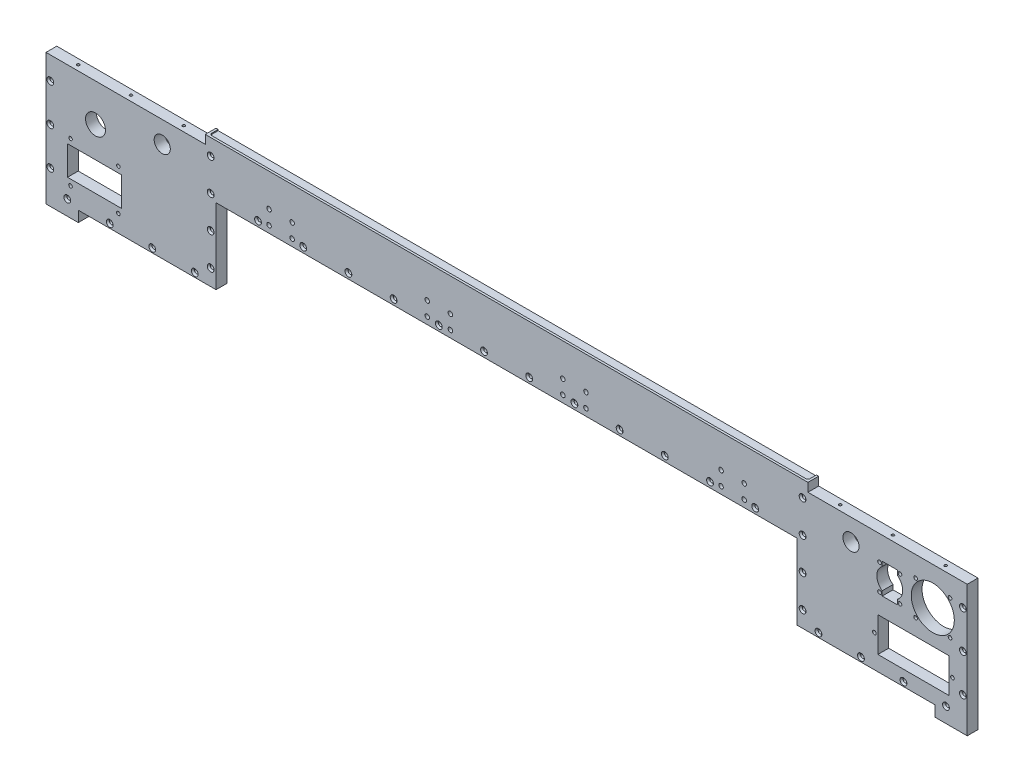
from build123d import *

# Parameters (mm, degrees)
BOSS_EXTRUDE1_DEPTH                          = 10
M3X0_5_TAPPED_HOLE1_AT_2_COUNT               = 2
M3X0_5_TAPPED_HOLE1_AT_2_PITCH               = 49
M3X0_5_TAPPED_HOLE1_AT_3_COUNT               = 2
M3X0_5_TAPPED_HOLE1_AT_3_PITCH               = 98
CSK_FOR_M3_COUNTERSUNK_FLAT_HEAD1_AT_2_COUNT = 2
CSK_FOR_M3_COUNTERSUNK_FLAT_HEAD1_AT_2_PITCH = 39.5
CSK_FOR_M3_COUNTERSUNK_FLAT_HEAD1_AT_3_COUNT = 2
CSK_FOR_M3_COUNTERSUNK_FLAT_HEAD1_AT_3_PITCH = 79
CSK_FOR_M3_COUNTERSUNK_FLAT_HEAD1_AT_4_COUNT = 2
CSK_FOR_M3_COUNTERSUNK_FLAT_HEAD1_AT_4_PITCH = 118.5
CSK_FOR_M3_COUNTERSUNK_FLAT_HEAD2_AT_2_COUNT = 2
CSK_FOR_M3_COUNTERSUNK_FLAT_HEAD2_AT_2_PITCH = 35
CSK_FOR_M3_COUNTERSUNK_FLAT_HEAD2_AT_3_COUNT = 2
CSK_FOR_M3_COUNTERSUNK_FLAT_HEAD2_AT_3_PITCH = 70
CSK_FOR_M3_COUNTERSUNK_FLAT_HEAD3_AT_2_COUNT = 2
CSK_FOR_M3_COUNTERSUNK_FLAT_HEAD3_AT_2_PITCH = 30
CSK_FOR_M3_COUNTERSUNK_FLAT_HEAD3_AT_3_COUNT = 2
CSK_FOR_M3_COUNTERSUNK_FLAT_HEAD3_AT_3_PITCH = 60
CSK_FOR_M3_COUNTERSUNK_FLAT_HEAD3_AT_4_COUNT = 2
CSK_FOR_M3_COUNTERSUNK_FLAT_HEAD3_AT_4_PITCH = 90
CSK_FOR_M3_COUNTERSUNK_FLAT_HEAD4_AT_2_COUNT = 2
CSK_FOR_M3_COUNTERSUNK_FLAT_HEAD4_AT_2_PITCH = 42
CSK_FOR_M3_COUNTERSUNK_FLAT_HEAD4_AT_3_COUNT = 2
CSK_FOR_M3_COUNTERSUNK_FLAT_HEAD4_AT_3_PITCH = 84
CSK_FOR_M3_COUNTERSUNK_FLAT_HEAD4_AT_4_COUNT = 2
CSK_FOR_M3_COUNTERSUNK_FLAT_HEAD4_AT_4_PITCH = 126
CSK_FOR_M3_COUNTERSUNK_FLAT_HEAD4_AT_5_COUNT = 2
CSK_FOR_M3_COUNTERSUNK_FLAT_HEAD4_AT_5_PITCH = 168
CSK_FOR_M3_COUNTERSUNK_FLAT_HEAD4_AT_6_COUNT = 2
CSK_FOR_M3_COUNTERSUNK_FLAT_HEAD4_AT_6_PITCH = 210
SKETCH14_W                                   = 556
SKETCH14_H                                   = 8
CUT_EXTRUDE1_DEPTH                           = 1
FILLET1_R                                    = 2
SKETCH17_R                                   = 20
SKETCH17_W                                   = 66
SKETCH17_H                                   = 32
CUT_EXTRUDE4_DEPTH                           = 436.527266655
F_3_4_3_4_DIAMETER_HOLE1_D                   = 3.4
M4X0_7_TAPPED_HOLE1_D                        = 3.3
SKETCH21_W                                   = 50
SKETCH21_H                                   = 27
CUT_EXTRUDE5_DEPTH                           = 436.527266655
M5X0_8_TAPPED_HOLE1_D                        = 4.2
LPATTERN1_COUNT                              = 2
LPATTERN1_PITCH                              = 147
MIRROR2_COPY_1_D                             = 4.2
M20X1_5_TAPPED_HOLE1_D                       = 18.5
F_15_0_15_DIAMETER_HOLE1_D                   = 15


with BuildPart() as part:
    # Sketch1 → Boss-Extrude1 (new body)
    with BuildSketch(Plane.XY):
        Polygon((270, 0), (-270, 0), (-270, -70), (-398, -70), (-398, -80), (-428, -80), (-428, 42), (-280, 42), (-280, 50), (280, 50), (280, 42), (428, 42), (428, -80), (398, -80), (398, -70), (270, -70), align=None)
    extrude(amount=BOSS_EXTRUDE1_DEPTH)

    # Sketch4 → M3x0.5 Tapped Hole1 (revolve, cut)
    with BuildSketch(Plane(origin=(-403, 42, 5), x_dir=(0, 0, 1), z_dir=(1, 0, 0))):
        Polygon((0, 0), (0, 12.251075774), (1.25, 11.5), (1.25, 0), align=None)
    m3x0_5_tapped_hole1 = revolve(axis=Axis((-403, 48.35, 5), (0, -1, 0)), mode=Mode.SUBTRACT)

    # M3x0.5 Tapped Hole1 at 2: M3x0.5 Tapped Hole1 ×2
    with Locations(*[(i * M3X0_5_TAPPED_HOLE1_AT_2_PITCH, 0, 0) for i in range(1, M3X0_5_TAPPED_HOLE1_AT_2_COUNT)]):
        add(m3x0_5_tapped_hole1, mode=Mode.SUBTRACT)

    # M3x0.5 Tapped Hole1 at 3: M3x0.5 Tapped Hole1 ×2
    with Locations(*[(i * M3X0_5_TAPPED_HOLE1_AT_3_PITCH, 0, 0) for i in range(1, M3X0_5_TAPPED_HOLE1_AT_3_COUNT)]):
        add(m3x0_5_tapped_hole1, mode=Mode.SUBTRACT)

    # Sketch6 → CSK for M3 Countersunk Flat Head1 (revolve, cut)
    with BuildSketch(Plane(origin=(-408.25, -66, 10), x_dir=(0, -1, 0), z_dir=(1, 0, 0))):
        Polygon((0, 0), (0, 12.521463052), (1.7, 11.5), (1.7, 1.45), (3.15, 0), align=None)
    csk_for_m3_countersunk_flat_head1 = revolve(axis=Axis((-408.25, -66, 16.35), (0, 0, -1)), mode=Mode.SUBTRACT)

    # CSK for M3 Countersunk Flat Head1 at 2: CSK for M3 Countersunk Flat Head1 ×2
    with Locations(*[(i * CSK_FOR_M3_COUNTERSUNK_FLAT_HEAD1_AT_2_PITCH, 0, 0) for i in range(1, CSK_FOR_M3_COUNTERSUNK_FLAT_HEAD1_AT_2_COUNT)]):
        add(csk_for_m3_countersunk_flat_head1, mode=Mode.SUBTRACT)

    # CSK for M3 Countersunk Flat Head1 at 3: CSK for M3 Countersunk Flat Head1 ×2
    with Locations(*[(i * CSK_FOR_M3_COUNTERSUNK_FLAT_HEAD1_AT_3_PITCH, 0, 0) for i in range(1, CSK_FOR_M3_COUNTERSUNK_FLAT_HEAD1_AT_3_COUNT)]):
        add(csk_for_m3_countersunk_flat_head1, mode=Mode.SUBTRACT)

    # CSK for M3 Countersunk Flat Head1 at 4: CSK for M3 Countersunk Flat Head1 ×2
    with Locations(*[(i * CSK_FOR_M3_COUNTERSUNK_FLAT_HEAD1_AT_4_PITCH, 0, 0) for i in range(1, CSK_FOR_M3_COUNTERSUNK_FLAT_HEAD1_AT_4_COUNT)]):
        add(csk_for_m3_countersunk_flat_head1, mode=Mode.SUBTRACT)

    # Sketch8 → CSK for M3 Countersunk Flat Head2 (revolve, cut)
    with BuildSketch(Plane(origin=(-424, 21, 10), x_dir=(0, -1, 0), z_dir=(1, 0, 0))):
        Polygon((0, 0), (0, 12.521463052), (1.7, 11.5), (1.7, 1.45), (3.15, 0), align=None)
    csk_for_m3_countersunk_flat_head2 = revolve(axis=Axis((-424, 21, 16.35), (0, 0, -1)), mode=Mode.SUBTRACT)

    # CSK for M3 Countersunk Flat Head2 at 2: CSK for M3 Countersunk Flat Head2 ×2
    with Locations(*[(0, -i * CSK_FOR_M3_COUNTERSUNK_FLAT_HEAD2_AT_2_PITCH, 0) for i in range(1, CSK_FOR_M3_COUNTERSUNK_FLAT_HEAD2_AT_2_COUNT)]):
        add(csk_for_m3_countersunk_flat_head2, mode=Mode.SUBTRACT)

    # CSK for M3 Countersunk Flat Head2 at 3: CSK for M3 Countersunk Flat Head2 ×2
    with Locations(*[(0, -i * CSK_FOR_M3_COUNTERSUNK_FLAT_HEAD2_AT_3_PITCH, 0) for i in range(1, CSK_FOR_M3_COUNTERSUNK_FLAT_HEAD2_AT_3_COUNT)]):
        add(csk_for_m3_countersunk_flat_head2, mode=Mode.SUBTRACT)

    # Sketch11 → CSK for M3 Countersunk Flat Head3 (revolve, cut)
    with BuildSketch(Plane(origin=(-275, 35, 10), x_dir=(0, -1, 0), z_dir=(1, 0, 0))):
        Polygon((0, 0), (0, 12.521463052), (1.7, 11.5), (1.7, 1.45), (3.15, 0), align=None)
    csk_for_m3_countersunk_flat_head3 = revolve(axis=Axis((-275, 35, 16.35), (0, 0, -1)), mode=Mode.SUBTRACT)

    # CSK for M3 Countersunk Flat Head3 at 2: CSK for M3 Countersunk Flat Head3 ×2
    with Locations(*[(0, -i * CSK_FOR_M3_COUNTERSUNK_FLAT_HEAD3_AT_2_PITCH, 0) for i in range(1, CSK_FOR_M3_COUNTERSUNK_FLAT_HEAD3_AT_2_COUNT)]):
        add(csk_for_m3_countersunk_flat_head3, mode=Mode.SUBTRACT)

    # CSK for M3 Countersunk Flat Head3 at 3: CSK for M3 Countersunk Flat Head3 ×2
    with Locations(*[(0, -i * CSK_FOR_M3_COUNTERSUNK_FLAT_HEAD3_AT_3_PITCH, 0) for i in range(1, CSK_FOR_M3_COUNTERSUNK_FLAT_HEAD3_AT_3_COUNT)]):
        add(csk_for_m3_countersunk_flat_head3, mode=Mode.SUBTRACT)

    # CSK for M3 Countersunk Flat Head3 at 4: CSK for M3 Countersunk Flat Head3 ×2
    with Locations(*[(0, -i * CSK_FOR_M3_COUNTERSUNK_FLAT_HEAD3_AT_4_PITCH, 0) for i in range(1, CSK_FOR_M3_COUNTERSUNK_FLAT_HEAD3_AT_4_COUNT)]):
        add(csk_for_m3_countersunk_flat_head3, mode=Mode.SUBTRACT)

    # Sketch13 → CSK for M3 Countersunk Flat Head4 (revolve, cut)
    with BuildSketch(Plane(origin=(-231, 5, 10), x_dir=(0, -1, 0), z_dir=(1, 0, 0))):
        Polygon((0, 0), (0, 12.521463052), (1.7, 11.5), (1.7, 1.45), (3.15, 0), align=None)
    csk_for_m3_countersunk_flat_head4 = revolve(axis=Axis((-231, 5, 16.35), (0, 0, -1)), mode=Mode.SUBTRACT)

    # CSK for M3 Countersunk Flat Head4 at 2: CSK for M3 Countersunk Flat Head4 ×2
    with Locations(*[(i * CSK_FOR_M3_COUNTERSUNK_FLAT_HEAD4_AT_2_PITCH, 0, 0) for i in range(1, CSK_FOR_M3_COUNTERSUNK_FLAT_HEAD4_AT_2_COUNT)]):
        add(csk_for_m3_countersunk_flat_head4, mode=Mode.SUBTRACT)

    # CSK for M3 Countersunk Flat Head4 at 3: CSK for M3 Countersunk Flat Head4 ×2
    with Locations(*[(i * CSK_FOR_M3_COUNTERSUNK_FLAT_HEAD4_AT_3_PITCH, 0, 0) for i in range(1, CSK_FOR_M3_COUNTERSUNK_FLAT_HEAD4_AT_3_COUNT)]):
        add(csk_for_m3_countersunk_flat_head4, mode=Mode.SUBTRACT)

    # CSK for M3 Countersunk Flat Head4 at 4: CSK for M3 Countersunk Flat Head4 ×2
    with Locations(*[(i * CSK_FOR_M3_COUNTERSUNK_FLAT_HEAD4_AT_4_PITCH, 0, 0) for i in range(1, CSK_FOR_M3_COUNTERSUNK_FLAT_HEAD4_AT_4_COUNT)]):
        add(csk_for_m3_countersunk_flat_head4, mode=Mode.SUBTRACT)

    # CSK for M3 Countersunk Flat Head4 at 5: CSK for M3 Countersunk Flat Head4 ×2
    with Locations(*[(i * CSK_FOR_M3_COUNTERSUNK_FLAT_HEAD4_AT_5_PITCH, 0, 0) for i in range(1, CSK_FOR_M3_COUNTERSUNK_FLAT_HEAD4_AT_5_COUNT)]):
        add(csk_for_m3_countersunk_flat_head4, mode=Mode.SUBTRACT)

    # CSK for M3 Countersunk Flat Head4 at 6: CSK for M3 Countersunk Flat Head4 ×2
    with Locations(*[(i * CSK_FOR_M3_COUNTERSUNK_FLAT_HEAD4_AT_6_PITCH, 0, 0) for i in range(1, CSK_FOR_M3_COUNTERSUNK_FLAT_HEAD4_AT_6_COUNT)]):
        add(csk_for_m3_countersunk_flat_head4, mode=Mode.SUBTRACT)

    # Mirror1: M3x0.5 Tapped Hole1, CSK for M3 Countersunk Flat Head1, CSK for M3 Countersunk Flat Head2, CSK for M3 Countersunk Flat Head3, CSK for M3 Countersunk Flat Head4 across plane
    add(m3x0_5_tapped_hole1.mirror(Plane(origin=(0, 0, 0), x_dir=(0, 0, 1), z_dir=(1, 0, 0))), mode=Mode.SUBTRACT)
    add(csk_for_m3_countersunk_flat_head1.mirror(Plane(origin=(0, 0, 0), x_dir=(0, 0, 1), z_dir=(1, 0, 0))), mode=Mode.SUBTRACT)
    add(csk_for_m3_countersunk_flat_head2.mirror(Plane(origin=(0, 0, 0), x_dir=(0, 0, 1), z_dir=(1, 0, 0))), mode=Mode.SUBTRACT)
    add(csk_for_m3_countersunk_flat_head3.mirror(Plane(origin=(0, 0, 0), x_dir=(0, 0, 1), z_dir=(1, 0, 0))), mode=Mode.SUBTRACT)
    add(csk_for_m3_countersunk_flat_head4.mirror(Plane(origin=(0, 0, 0), x_dir=(0, 0, 1), z_dir=(1, 0, 0))), mode=Mode.SUBTRACT)

    # Mirror1 copy 1 sketch → Mirror1 copy 1 (revolve, cut)
    with BuildSketch(Plane(origin=(354, 42, 5), x_dir=(0, 0, 1), z_dir=(-1, 0, 0))):
        Polygon((0, 0), (0, -12.251075774), (1.25, -11.5), (1.25, 0), align=None)
    revolve(axis=Axis((354, 48.35, 5), (0, 1, 0)), mode=Mode.SUBTRACT)

    # Mirror1 copy 2 sketch → Mirror1 copy 2 (revolve, cut)
    with BuildSketch(Plane(origin=(305, 42, 5), x_dir=(0, 0, 1), z_dir=(-1, 0, 0))):
        Polygon((0, 0), (0, -12.251075774), (1.25, -11.5), (1.25, 0), align=None)
    revolve(axis=Axis((305, 48.35, 5), (0, 1, 0)), mode=Mode.SUBTRACT)

    # Mirror1 copy 3 sketch → Mirror1 copy 3 (revolve, cut)
    with BuildSketch(Plane(origin=(368.75, -66, 10), x_dir=(0, -1, 0), z_dir=(-1, 0, 0))):
        Polygon((0, 0), (0, -12.521463052), (1.7, -11.5), (1.7, -1.45), (3.15, 0), align=None)
    revolve(axis=Axis((368.75, -66, 16.35), (0, 0, 1)), mode=Mode.SUBTRACT)

    # Mirror1 copy 4 sketch → Mirror1 copy 4 (revolve, cut)
    with BuildSketch(Plane(origin=(329.25, -66, 10), x_dir=(0, -1, 0), z_dir=(-1, 0, 0))):
        Polygon((0, 0), (0, -12.521463052), (1.7, -11.5), (1.7, -1.45), (3.15, 0), align=None)
    revolve(axis=Axis((329.25, -66, 16.35), (0, 0, 1)), mode=Mode.SUBTRACT)

    # Mirror1 copy 5 sketch → Mirror1 copy 5 (revolve, cut)
    with BuildSketch(Plane(origin=(289.75, -66, 10), x_dir=(0, -1, 0), z_dir=(-1, 0, 0))):
        Polygon((0, 0), (0, -12.521463052), (1.7, -11.5), (1.7, -1.45), (3.15, 0), align=None)
    revolve(axis=Axis((289.75, -66, 16.35), (0, 0, 1)), mode=Mode.SUBTRACT)

    # Mirror1 copy 6 sketch → Mirror1 copy 6 (revolve, cut)
    with BuildSketch(Plane(origin=(424, -14, 10), x_dir=(0, -1, 0), z_dir=(-1, 0, 0))):
        Polygon((0, 0), (0, -12.521463052), (1.7, -11.5), (1.7, -1.45), (3.15, 0), align=None)
    revolve(axis=Axis((424, -14, 16.35), (0, 0, 1)), mode=Mode.SUBTRACT)

    # Mirror1 copy 7 sketch → Mirror1 copy 7 (revolve, cut)
    with BuildSketch(Plane(origin=(424, -49, 10), x_dir=(0, -1, 0), z_dir=(-1, 0, 0))):
        Polygon((0, 0), (0, -12.521463052), (1.7, -11.5), (1.7, -1.45), (3.15, 0), align=None)
    revolve(axis=Axis((424, -49, 16.35), (0, 0, 1)), mode=Mode.SUBTRACT)

    # Mirror1 copy 8 sketch → Mirror1 copy 8 (revolve, cut)
    with BuildSketch(Plane(origin=(275, 5, 10), x_dir=(0, -1, 0), z_dir=(-1, 0, 0))):
        Polygon((0, 0), (0, -12.521463052), (1.7, -11.5), (1.7, -1.45), (3.15, 0), align=None)
    revolve(axis=Axis((275, 5, 16.35), (0, 0, 1)), mode=Mode.SUBTRACT)

    # Mirror1 copy 9 sketch → Mirror1 copy 9 (revolve, cut)
    with BuildSketch(Plane(origin=(275, -25, 10), x_dir=(0, -1, 0), z_dir=(-1, 0, 0))):
        Polygon((0, 0), (0, -12.521463052), (1.7, -11.5), (1.7, -1.45), (3.15, 0), align=None)
    revolve(axis=Axis((275, -25, 16.35), (0, 0, 1)), mode=Mode.SUBTRACT)

    # Mirror1 copy 10 sketch → Mirror1 copy 10 (revolve, cut)
    with BuildSketch(Plane(origin=(275, -55, 10), x_dir=(0, -1, 0), z_dir=(-1, 0, 0))):
        Polygon((0, 0), (0, -12.521463052), (1.7, -11.5), (1.7, -1.45), (3.15, 0), align=None)
    revolve(axis=Axis((275, -55, 16.35), (0, 0, 1)), mode=Mode.SUBTRACT)

    # Mirror1 copy 11 sketch → Mirror1 copy 11 (revolve, cut)
    with BuildSketch(Plane(origin=(189, 5, 10), x_dir=(0, -1, 0), z_dir=(-1, 0, 0))):
        Polygon((0, 0), (0, -12.521463052), (1.7, -11.5), (1.7, -1.45), (3.15, 0), align=None)
    revolve(axis=Axis((189, 5, 16.35), (0, 0, 1)), mode=Mode.SUBTRACT)

    # Mirror1 copy 12 sketch → Mirror1 copy 12 (revolve, cut)
    with BuildSketch(Plane(origin=(147, 5, 10), x_dir=(0, -1, 0), z_dir=(-1, 0, 0))):
        Polygon((0, 0), (0, -12.521463052), (1.7, -11.5), (1.7, -1.45), (3.15, 0), align=None)
    revolve(axis=Axis((147, 5, 16.35), (0, 0, 1)), mode=Mode.SUBTRACT)

    # Mirror1 copy 13 sketch → Mirror1 copy 13 (revolve, cut)
    with BuildSketch(Plane(origin=(105, 5, 10), x_dir=(0, -1, 0), z_dir=(-1, 0, 0))):
        Polygon((0, 0), (0, -12.521463052), (1.7, -11.5), (1.7, -1.45), (3.15, 0), align=None)
    revolve(axis=Axis((105, 5, 16.35), (0, 0, 1)), mode=Mode.SUBTRACT)

    # Mirror1 copy 14 sketch → Mirror1 copy 14 (revolve, cut)
    with BuildSketch(Plane(origin=(63, 5, 10), x_dir=(0, -1, 0), z_dir=(-1, 0, 0))):
        Polygon((0, 0), (0, -12.521463052), (1.7, -11.5), (1.7, -1.45), (3.15, 0), align=None)
    revolve(axis=Axis((63, 5, 16.35), (0, 0, 1)), mode=Mode.SUBTRACT)

    # Mirror1 copy 15 sketch → Mirror1 copy 15 (revolve, cut)
    with BuildSketch(Plane(origin=(21, 5, 10), x_dir=(0, -1, 0), z_dir=(-1, 0, 0))):
        Polygon((0, 0), (0, -12.521463052), (1.7, -11.5), (1.7, -1.45), (3.15, 0), align=None)
    revolve(axis=Axis((21, 5, 16.35), (0, 0, 1)), mode=Mode.SUBTRACT)

    # Sketch14 → Cut-Extrude1 (cut)
    with BuildSketch(Plane(origin=(0, 50, 0), x_dir=(1, 0, 0), z_dir=(0, 1, 0))):
        with Locations((0, -4)):
            Rectangle(SKETCH14_W, SKETCH14_H)
    extrude(amount=-CUT_EXTRUDE1_DEPTH, mode=Mode.SUBTRACT)

    # Fillet1
    fillet1_edges = [part.edges().sort_by_distance(p)[0] for p in [
        (-278, 49.5, 8),
        (278, 49.5, 8),
    ]]
    fillet(fillet1_edges, radius=FILLET1_R)

    # Sketch17 → Cut-Extrude4 (cut, through all)
    with BuildSketch(Plane.XY.offset(10)):
        with Locations((396, 7)):
            Circle(SKETCH17_R)
        with Locations((378, -40)):
            Rectangle(SKETCH17_W, SKETCH17_H)
        with BuildLine():
            Line((349, 16.746794345), (349, 21))
            Line((349, 21), (363, 21))
            Line((363, 21), (363, 16.746794345))
            ThreePointArc((363, 16.746794345), (368, 7), (363, -2.746794345))
            Line((363, -2.746794345), (363, -7))
            Line((363, -7), (349, -7))
            Line((349, -7), (349, -2.746794345))
            ThreePointArc((349, -2.746794345), (344, 7), (349, 16.746794345))
        make_face()
    extrude(amount=-CUT_EXTRUDE4_DEPTH, mode=Mode.SUBTRACT)

    # Ø3.4 (3.4) Diameter Hole1 (through all)
    with Locations(Plane(origin=(346.5, 19, 10), x_dir=(1, 0, 0), z_dir=(0, 0, 1))):
        with Locations((0, 0), (19, 0), (19, -24), (0, -24), (65.5, 4), (33.5, 4), (33.5, -28), (65.5, -28), (-4.75, -59), (67.75, -59)):
            Hole(F_3_4_3_4_DIAMETER_HOLE1_D / 2)

    # M4x0.7 Tapped Hole1 (through all)
    with Locations(Plane(origin=(-405.225, -15.95, 10), x_dir=(1, 0, 0), z_dir=(0, 0, 1))):
        with Locations((0, 0), (44.45, 0), (44.45, -38.1), (0, -38.1)):
            Hole(M4X0_7_TAPPED_HOLE1_D / 2)

    # Sketch21 → Cut-Extrude5 (cut, through all)
    with BuildSketch(Plane.XY.offset(10)):
        with Locations((-383, -35)):
            Rectangle(SKETCH21_W, SKETCH21_H)
    extrude(amount=-CUT_EXTRUDE5_DEPTH, mode=Mode.SUBTRACT)

    # M5x0.8 Tapped Hole1 (through all)
    with Locations(Plane(origin=(-73.75, 19.5, 10), x_dir=(1, 0, 0), z_dir=(0, 0, 1))):
        with Locations((0, 0), (0, -13), (21.5, 0), (21.5, -13)):
            m5x0_8_tapped_hole1 = Hole(M5X0_8_TAPPED_HOLE1_D / 2)

    # LPattern1: M5x0.8 Tapped Hole1 ×2
    with Locations(*[(-i * LPATTERN1_PITCH, 0, 0) for i in range(1, LPATTERN1_COUNT)]):
        add(m5x0_8_tapped_hole1, mode=Mode.SUBTRACT)

    # Mirror2: M5x0.8 Tapped Hole1 across plane
    add(m5x0_8_tapped_hole1.mirror(Plane(origin=(0, 0, 0), x_dir=(0, 0, 1), z_dir=(1, 0, 0))), mode=Mode.SUBTRACT)

    # Mirror2 copy 1 (through all)
    with Locations(Plane(origin=(220.75, 19.5, 10), x_dir=(-1, 0, 0), z_dir=(0, 0, 1))):
        with Locations((0, 0), (0, 13), (21.5, 0), (21.5, 13)):
            Hole(MIRROR2_COPY_1_D / 2)

    # M20x1.5 Tapped Hole1 (through all)
    with Locations(Plane(origin=(-382, 7, 10), x_dir=(1, 0, 0), z_dir=(0, 0, 1))):
        with Locations((0, 0)):
            Hole(M20X1_5_TAPPED_HOLE1_D / 2)

    # Ø15.0 (15) Diameter Hole1 (through all)
    with Locations(Plane(origin=(-320, 22, 10), x_dir=(1, 0, 0), z_dir=(0, 0, 1))):
        with Locations((0, 0)):
            f_15_0_15_diameter_hole1 = Hole(F_15_0_15_DIAMETER_HOLE1_D / 2)

    # Mirror3: Ø15.0 (15) Diameter Hole1 across plane
    add(f_15_0_15_diameter_hole1.mirror(Plane(origin=(0, 0, 0), x_dir=(0, 0, 1), z_dir=(1, 0, 0))), mode=Mode.SUBTRACT)


solid = part.part
